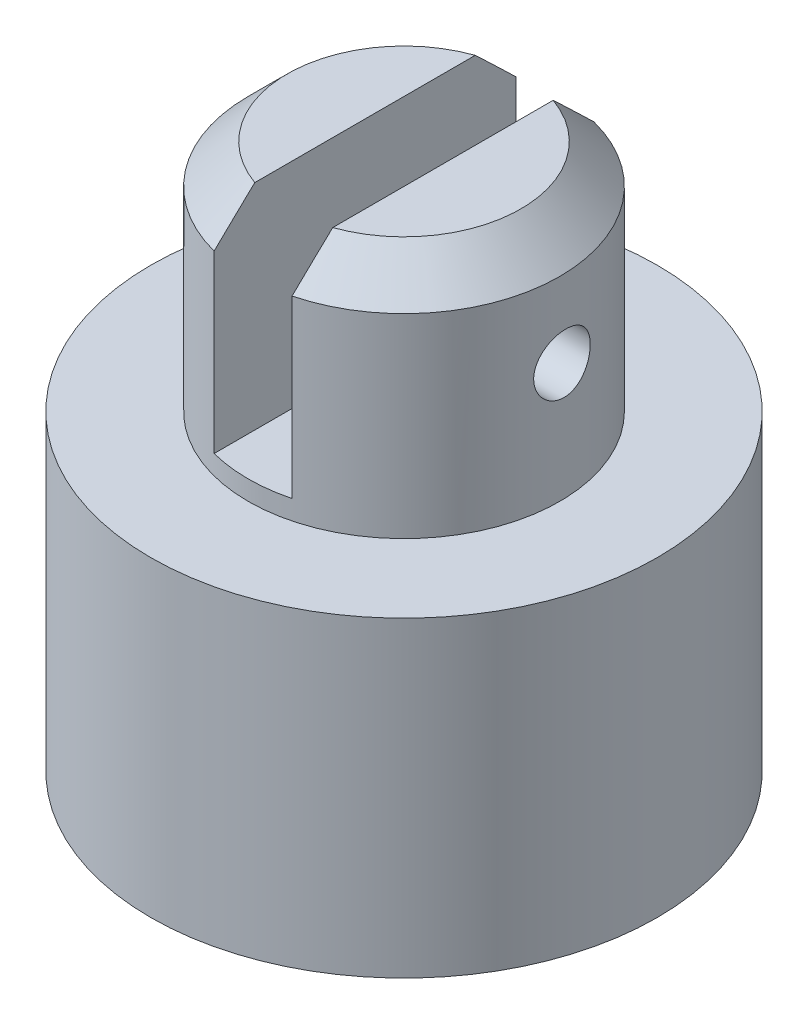
from build123d import *

# Parameters (mm, degrees)
SKETCH1_R               = 6.5
BOSS_EXTRUDE1_DEPTH     = 8
SKETCH2_R               = 4
BOSS_EXTRUDE2_DEPTH     = 6
SKETCH3_W               = 2
SKETCH3_H               = 9
CUT_EXTRUDE1_DEPTH      = 5.5
CHAMFER1_SIZE           = 1
CHAMFER2_SIZE           = 1
CUT_EXTRUDE3_DEPTH      = 5.5
CUT_EXTRUDE3_DEPTH_BACK = 5.5
SKETCH5_R               = 0.75


with BuildPart() as part:
    # Sketch1 → Boss-Extrude1 (new body)
    with BuildSketch(Plane(origin=(0, 0, 0), x_dir=(1, 0, 0), z_dir=(0, 1, 0))):
        with Locations(Location((0, 0, 0), (0, 0, 270))):
            Circle(SKETCH1_R)
    extrude(amount=BOSS_EXTRUDE1_DEPTH)

    # Sketch2 → Boss-Extrude2 (add)
    with BuildSketch(Plane(origin=(0, 8, 0), x_dir=(1, 0, 0), z_dir=(0, 1, 0))):
        with Locations(Location((0, 0, 0), (0, 0, 270))):
            Circle(SKETCH2_R)
    extrude(amount=BOSS_EXTRUDE2_DEPTH)

    # Sketch3 → Cut-Extrude1 (cut)
    with BuildSketch(Plane(origin=(0, 14, 0), x_dir=(1, 0, 0), z_dir=(0, 1, 0))):
        Rectangle(SKETCH3_W, SKETCH3_H)
    extrude(amount=-CUT_EXTRUDE1_DEPTH, mode=Mode.SUBTRACT)

    # Chamfer1
    chamfer1_edges = [part.edges().sort_by_distance(p)[0] for p in [
        (4, 14, 0),
    ]]
    chamfer(chamfer1_edges, length=CHAMFER1_SIZE)

    # Chamfer2
    chamfer2_edges = [part.edges().sort_by_distance(p)[0] for p in [
        (-4, 14, 0),
    ]]
    chamfer(chamfer2_edges, length=CHAMFER2_SIZE)

    # Sketch5 → Cut-Extrude3 (cut, two sides: drawn at the far end of the back side and taken through both)
    with BuildSketch(Plane(origin=(0, 0, 0), x_dir=(0, 0, -1), z_dir=(1, 0, 0)).offset(-CUT_EXTRUDE3_DEPTH_BACK)):
        with Locations(Location((0.127016654, 11.002690078, 0), (0, 0, 180))):
            Circle(SKETCH5_R)
    extrude(amount=CUT_EXTRUDE3_DEPTH + CUT_EXTRUDE3_DEPTH_BACK, mode=Mode.SUBTRACT)


solid = part.part
